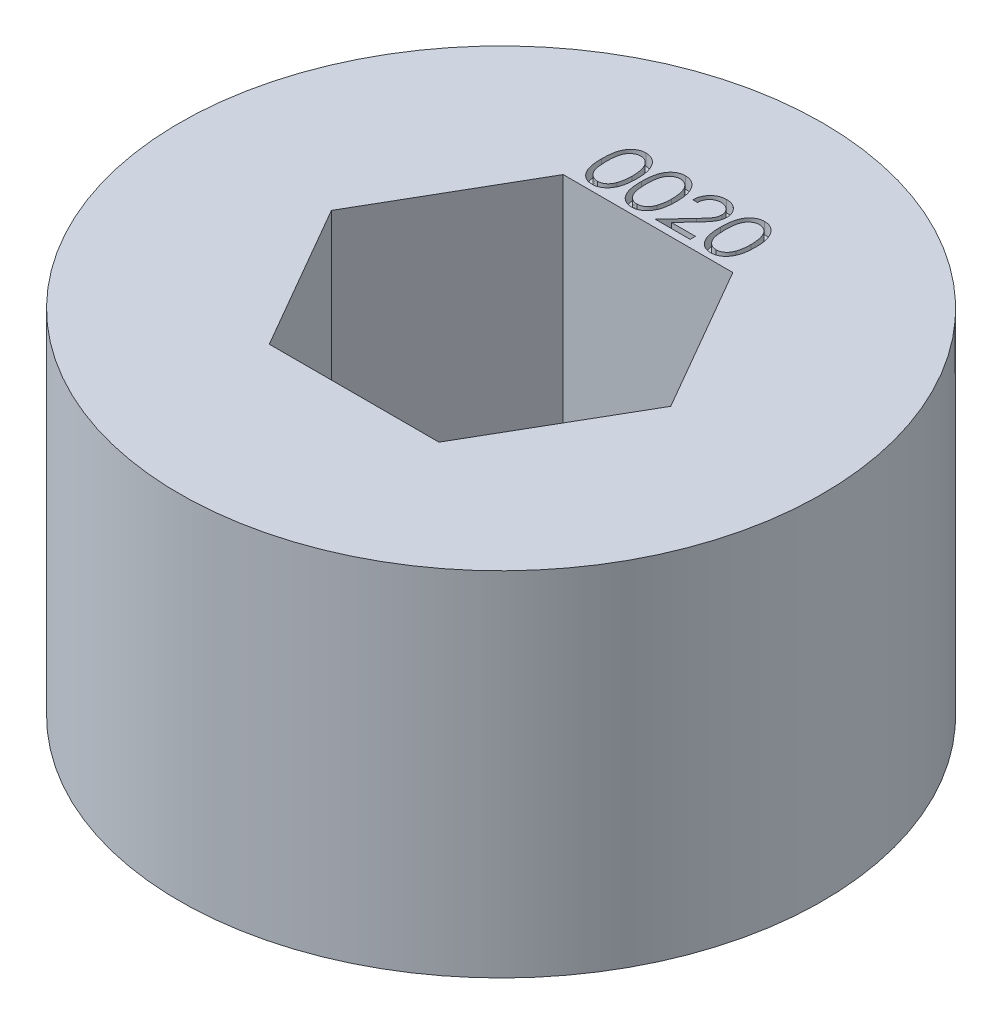
from build123d import *

# Parameters (mm, degrees)
SKETCH1_R           = 11.1125
BOSS_EXTRUDE1_DEPTH = 12.192
CUT_EXTRUDE1_DEPTH  = 0.4


with BuildPart() as part:
    # Sketch1 → Boss-Extrude1 (new body)
    with BuildSketch(Plane(origin=(0, 0, 0), x_dir=(1, 0, 0), z_dir=(0, 1, 0))):
        with Locations(Location((0, 0, 0), (0, 0, 90))):
            Circle(SKETCH1_R)
        Polygon((-2.932939367, 5.08), (-5.865878735, 0), (-2.932939367, -5.08), (2.932939367, -5.08), (5.865878735, 0), (2.932939367, 5.08), align=None, mode=Mode.SUBTRACT)
    extrude(amount=BOSS_EXTRUDE1_DEPTH)

    # Sketch2 → Cut-Extrude1 (cut)
    # profile 1 of 4: a face of its own
    with BuildSketch(Plane(origin=(0, 12.192, 0), x_dir=(1, 0, 0), z_dir=(0, 1, 0))):
        with BuildLine():
            add(Edge.make_bspline(
                [(-2.741641314, 6.22228766), (-2.741474681, 6.250785133), (-2.741150993, 6.306141885), (-2.737550075, 6.386804483), (-2.731568201, 6.46247631), (-2.723370416, 6.533160988), (-2.713394322, 6.598876764), (-2.700076855, 6.659448021), (-2.684931951, 6.715155101), (-2.667379309, 6.766179662), (-2.647573512, 6.813209135), (-2.626016907, 6.857113137), (-2.601853992, 6.897825239), (-2.57646572, 6.935995236), (-2.548824388, 6.970998313), (-2.519716602, 7.003328786), (-2.488006289, 7.032239447), (-2.454771401, 7.058577368), (-2.419711037, 7.0816657), (-2.383824562, 7.102002331), (-2.346864969, 7.119375864), (-2.308731348, 7.133036205), (-2.269766448, 7.144319315), (-2.229834058, 7.152035301), (-2.188868246, 7.15689021), (-2.161217077, 7.157354354), (-2.147193798, 7.157589744)],
                knots=[0, 0, 0, 0, 1.646270934, 3.197905019, 4.663502075, 6.030701355, 7.308322542, 8.50163776, 9.611534131, 10.641858119, 11.616356847, 12.558055219, 13.465016945, 14.349605745, 15.204443733, 16.039544428, 16.859896111, 17.680448484, 18.487036065, 19.28249412, 20.06191084, 20.843045899, 21.620316918, 22.403196591, 23.190181807, 24, 24, 24, 24], degree=3))
            add(Edge.make_bspline(
                [(-2.147193798, 7.157589744), (-2.133053375, 7.157341933), (-2.104932522, 7.156849117), (-2.063357612, 7.152112554), (-2.022743173, 7.144253224), (-1.983262359, 7.133117369), (-1.944590866, 7.119301965), (-1.907031171, 7.101985709), (-1.870349973, 7.081828845), (-1.835130187, 7.058143915), (-1.800985162, 7.031736919), (-1.768753597, 7.001885483), (-1.738432558, 6.968891026), (-1.709641502, 6.933106559), (-1.683197259, 6.893845736), (-1.658013955, 6.851791408), (-1.635472961, 6.806208129), (-1.613763746, 6.757856451), (-1.595025157, 6.705398512), (-1.578125904, 6.649130014), (-1.564471388, 6.588386327), (-1.553097638, 6.523486154), (-1.544286431, 6.454191153), (-1.537869049, 6.380649865), (-1.534479121, 6.302813906), (-1.533840717, 6.249596919), (-1.533513109, 6.22228766)],
                knots=[0, 0, 0, 0, 0.810914788, 1.612654377, 2.396697861, 3.181598691, 3.963628158, 4.749916497, 5.551656086, 6.361998678, 7.18212741, 8.025565596, 8.878627764, 9.750805457, 10.657531673, 11.591944965, 12.560506719, 13.57287815, 14.630710178, 15.753379473, 16.941251878, 18.199788006, 19.531962791, 20.947069417, 22.433333509, 24, 24, 24, 24], degree=3))
            add(Edge.make_bspline(
                [(-1.533513109, 6.22228766), (-1.533844114, 6.195097515), (-1.534489063, 6.142118626), (-1.537831046, 6.06463289), (-1.544414031, 5.991481884), (-1.552648705, 5.922490169), (-1.564053794, 5.857944899), (-1.578077219, 5.797622719), (-1.593647583, 5.741263131), (-1.612867658, 5.689327847), (-1.633904299, 5.641092371), (-1.656792339, 5.59604946), (-1.68131341, 5.553800983), (-1.708028493, 5.514685112), (-1.736503627, 5.478424754), (-1.767348263, 5.445659962), (-1.79969292, 5.41560126), (-1.833938428, 5.388854234), (-1.869707496, 5.365443153), (-1.906262707, 5.344506517), (-1.944252666, 5.327624308), (-1.982816446, 5.313128507), (-2.022505656, 5.302053877), (-2.063270822, 5.294396359), (-2.10490459, 5.28902586), (-2.133048585, 5.288616168), (-2.147193798, 5.288410256)],
                knots=[0, 0, 0, 0, 1.561518951, 3.042555995, 4.452378317, 5.7783523, 7.031515105, 8.214008947, 9.334062868, 10.386615937, 11.391082383, 12.354592575, 13.286541444, 14.194233754, 15.072674879, 15.931287219, 16.775624067, 17.606195743, 18.42308326, 19.229000347, 20.022332153, 20.807536673, 21.593273796, 22.3848459, 23.188221202, 24, 24, 24, 24], degree=3))
            add(Edge.make_bspline(
                [(-2.147193798, 5.288410256), (-2.161216688, 5.288647165), (-2.188867089, 5.289114302), (-2.229838522, 5.293947278), (-2.269606003, 5.301717394), (-2.30836577, 5.312597029), (-2.34631668, 5.325914165), (-2.382941593, 5.343264237), (-2.418647736, 5.363245944), (-2.453339847, 5.386002018), (-2.486366025, 5.412073433), (-2.517912116, 5.440909691), (-2.547185626, 5.473230384), (-2.574431746, 5.508525169), (-2.600326583, 5.546469336), (-2.624146385, 5.58758095), (-2.646178779, 5.631696996), (-2.666317672, 5.679102495), (-2.684173193, 5.730489198), (-2.699945429, 5.786444981), (-2.712398621, 5.847463724), (-2.723057962, 5.913055346), (-2.731655549, 5.983501703), (-2.737525146, 6.058841038), (-2.741152934, 6.139026404), (-2.74147555, 6.19402745), (-2.741641314, 6.22228766)],
                knots=[0, 0, 0, 0, 0.810891512, 1.598919785, 2.382837074, 3.152667961, 3.926044502, 4.706494248, 5.493654104, 6.291793342, 7.103789334, 7.925228297, 8.761435821, 9.622817696, 10.50288917, 11.416980706, 12.369136599, 13.353924996, 14.394355917, 15.514179734, 16.714354668, 17.994756427, 19.357759367, 20.818452758, 22.365282078, 24, 24, 24, 24], degree=3))
        make_face()
        with BuildLine():
            add(Edge.make_bspline(
                [(-2.582077211, 6.223), (-2.582016532, 6.199251661), (-2.581898766, 6.153160798), (-2.578822216, 6.086184422), (-2.574631098, 6.023715495), (-2.569225319, 5.965674698), (-2.561197421, 5.912258492), (-2.552202373, 5.863099493), (-2.541255944, 5.818457856), (-2.528304474, 5.778027248), (-2.513552613, 5.741121522), (-2.497446034, 5.706780104), (-2.480143187, 5.674597321), (-2.460778659, 5.644862248), (-2.439689007, 5.617477916), (-2.417350591, 5.591959637), (-2.392929718, 5.569202771), (-2.359145817, 5.541909529), (-2.314545208, 5.513705809), (-2.258350017, 5.489145995), (-2.200606444, 5.473711707), (-2.161413609, 5.471748919), (-2.14185125, 5.470769231)],
                knots=[0, 0, 0, 0, 1.459021318, 2.831673884, 4.118529203, 5.306027144, 6.411944654, 7.436330062, 8.375795394, 9.233974572, 10.042671642, 10.816086306, 11.563610507, 12.285937304, 12.993564865, 13.685989202, 14.367179055, 15.041617293, 16.353048772, 17.594441528, 18.799311195, 20, 20, 20, 20], degree=3))
            add(Edge.make_bspline(
                [(-2.14185125, 5.470769231), (-2.122162352, 5.471580903), (-2.082825208, 5.473202573), (-2.02535324, 5.488848332), (-1.969559463, 5.512454858), (-1.925834917, 5.54036819), (-1.892569785, 5.566950982), (-1.868735954, 5.589615223), (-1.846860434, 5.614992804), (-1.82611266, 5.642373646), (-1.807083449, 5.672280868), (-1.789779375, 5.704570656), (-1.773989035, 5.739332679), (-1.764992839, 5.763599706), (-1.760393317, 5.776006811)],
                knots=[0, 0, 0, 0, 1.353760809, 2.704726607, 4.075137775, 5.516104923, 6.260822281, 7.007110065, 7.778089737, 8.566572457, 9.372053459, 10.217411131, 11.088608312, 12, 12, 12, 12], degree=3))
            add(Edge.make_bspline(
                [(-1.760393317, 5.776006811), (-1.755033019, 5.791871519), (-1.744149315, 5.824083679), (-1.730122534, 5.874052414), (-1.719075871, 5.926479418), (-1.709137681, 5.981051377), (-1.702354329, 6.038170746), (-1.69689444, 6.097660789), (-1.693678451, 6.159566361), (-1.693279797, 6.201626216), (-1.693077211, 6.223)],
                knots=[0, 0, 0, 0, 0.884706709, 1.796334032, 2.740027952, 3.714592787, 4.726048262, 5.777819803, 6.87074269, 8, 8, 8, 8], degree=3))
            add(Edge.make_bspline(
                [(-1.693077211, 6.223), (-1.693356707, 6.244370327), (-1.693903461, 6.286175255), (-1.695993367, 6.34739849), (-1.701390143, 6.405548113), (-1.707384095, 6.460874633), (-1.716221884, 6.513071787), (-1.72575085, 6.562576542), (-1.738553066, 6.608775598), (-1.752228311, 6.652392266), (-1.767879992, 6.692930998), (-1.785109185, 6.730580802), (-1.803509839, 6.765523442), (-1.823495697, 6.797663048), (-1.844829504, 6.82714358), (-1.868074339, 6.853373954), (-1.89230816, 6.877167134), (-1.926251291, 6.904326119), (-1.97068823, 6.93201806), (-2.025981819, 6.957502266), (-2.083523306, 6.972136879), (-2.122422621, 6.974200216), (-2.14185125, 6.975230769)],
                knots=[0, 0, 0, 0, 1.31362396, 2.569729283, 3.763502607, 4.902122613, 5.988968491, 7.01645872, 7.998833611, 8.933434873, 9.825090667, 10.667526885, 11.477055099, 12.250526234, 12.991942729, 13.710640831, 14.402115721, 15.076753259, 16.378508321, 17.609869233, 18.806226677, 20, 20, 20, 20], degree=3))
            add(Edge.make_bspline(
                [(-2.14185125, 6.975230769), (-2.16151623, 6.974198794), (-2.200882017, 6.972132965), (-2.259021578, 6.957556792), (-2.314751389, 6.932150205), (-2.35907082, 6.9042344), (-2.393037623, 6.877646538), (-2.416955631, 6.854590219), (-2.439381887, 6.829369922), (-2.460041079, 6.801733749), (-2.479390434, 6.772033342), (-2.497160789, 6.74003505), (-2.513171592, 6.705576717), (-2.527946537, 6.668687568), (-2.540937513, 6.628260448), (-2.551653246, 6.583673799), (-2.561552669, 6.534671158), (-2.568560666, 6.480965648), (-2.574790654, 6.422910314), (-2.578794379, 6.360285437), (-2.581909057, 6.293196731), (-2.582020037, 6.246867559), (-2.582077211, 6.223)],
                knots=[0, 0, 0, 0, 1.207732386, 2.417664972, 3.655092373, 4.956220595, 5.625982001, 6.301752483, 6.994047911, 7.697131622, 8.419323945, 9.170223765, 9.943494443, 10.752040957, 11.610060368, 12.549350801, 13.567764191, 14.679664412, 15.874934091, 17.154273443, 18.533957287, 20, 20, 20, 20], degree=3))
        make_face(mode=Mode.SUBTRACT)
    # profile 2 of 4: a face of its own
    with BuildSketch(Plane(origin=(0, 12.192, 0), x_dir=(1, 0, 0), z_dir=(0, 1, 0))):
        with BuildLine():
            add(Edge.make_bspline(
                [(-1.373949006, 6.22228766), (-1.373782373, 6.250785133), (-1.373458685, 6.306141885), (-1.369857768, 6.386804483), (-1.363875894, 6.46247631), (-1.355678108, 6.533160988), (-1.345702014, 6.598876764), (-1.332384547, 6.659448021), (-1.317239643, 6.715155101), (-1.299687001, 6.766179662), (-1.279881204, 6.813209135), (-1.2583246, 6.857113137), (-1.234161684, 6.897825239), (-1.208773412, 6.935995236), (-1.18113208, 6.970998313), (-1.152024294, 7.003328786), (-1.120313981, 7.032239447), (-1.087079093, 7.058577368), (-1.052018729, 7.0816657), (-1.016132255, 7.102002331), (-0.979172661, 7.119375864), (-0.94103904, 7.133036205), (-0.902074141, 7.144319315), (-0.862141751, 7.152035301), (-0.821175938, 7.15689021), (-0.793524769, 7.157354354), (-0.77950149, 7.157589744)],
                knots=[0, 0, 0, 0, 1.646270934, 3.197905019, 4.663502075, 6.030701355, 7.308322542, 8.50163776, 9.611534131, 10.641858119, 11.616356847, 12.558055219, 13.465016945, 14.349605745, 15.204443733, 16.039544428, 16.859896111, 17.680448484, 18.487036065, 19.28249412, 20.06191084, 20.843045899, 21.620316918, 22.403196591, 23.190181807, 24, 24, 24, 24], degree=3))
            add(Edge.make_bspline(
                [(-0.77950149, 7.157589744), (-0.765361067, 7.157341933), (-0.737240214, 7.156849117), (-0.695665304, 7.152112554), (-0.655050865, 7.144253224), (-0.615570051, 7.133117369), (-0.576898558, 7.119301965), (-0.539338863, 7.101985709), (-0.502657665, 7.081828845), (-0.467437879, 7.058143915), (-0.433292855, 7.031736919), (-0.40106129, 7.001885483), (-0.37074025, 6.968891026), (-0.341949195, 6.933106559), (-0.315504951, 6.893845736), (-0.290321648, 6.851791408), (-0.267780654, 6.806208129), (-0.246071439, 6.757856451), (-0.227332849, 6.705398512), (-0.210433597, 6.649130014), (-0.196779081, 6.588386327), (-0.18540533, 6.523486154), (-0.176594123, 6.454191153), (-0.170176741, 6.380649865), (-0.166786814, 6.302813906), (-0.16614841, 6.249596919), (-0.165820801, 6.22228766)],
                knots=[0, 0, 0, 0, 0.810914788, 1.612654377, 2.396697861, 3.181598691, 3.963628158, 4.749916497, 5.551656086, 6.361998678, 7.18212741, 8.025565596, 8.878627764, 9.750805457, 10.657531673, 11.591944965, 12.560506719, 13.57287815, 14.630710178, 15.753379473, 16.941251878, 18.199788006, 19.531962791, 20.947069417, 22.433333509, 24, 24, 24, 24], degree=3))
            add(Edge.make_bspline(
                [(-0.165820801, 6.22228766), (-0.166151806, 6.195097515), (-0.166796756, 6.142118626), (-0.170138739, 6.06463289), (-0.176721723, 5.991481884), (-0.184956397, 5.922490169), (-0.196361486, 5.857944899), (-0.210384911, 5.797622719), (-0.225955275, 5.741263131), (-0.24517535, 5.689327847), (-0.266211991, 5.641092371), (-0.289100031, 5.59604946), (-0.313621102, 5.553800983), (-0.340336185, 5.514685112), (-0.368811319, 5.478424754), (-0.399655956, 5.445659962), (-0.432000613, 5.41560126), (-0.46624612, 5.388854234), (-0.502015188, 5.365443153), (-0.538570399, 5.344506517), (-0.576560358, 5.327624308), (-0.615124138, 5.313128507), (-0.654813348, 5.302053877), (-0.695578514, 5.294396359), (-0.737212282, 5.28902586), (-0.765356277, 5.288616168), (-0.77950149, 5.288410256)],
                knots=[0, 0, 0, 0, 1.561518951, 3.042555995, 4.452378317, 5.7783523, 7.031515105, 8.214008947, 9.334062868, 10.386615937, 11.391082383, 12.354592575, 13.286541444, 14.194233754, 15.072674879, 15.931287219, 16.775624067, 17.606195743, 18.42308326, 19.229000347, 20.022332153, 20.807536673, 21.593273796, 22.3848459, 23.188221202, 24, 24, 24, 24], degree=3))
            add(Edge.make_bspline(
                [(-0.77950149, 5.288410256), (-0.79352438, 5.288647165), (-0.821174782, 5.289114302), (-0.862146214, 5.293947278), (-0.901913695, 5.301717394), (-0.940673462, 5.312597029), (-0.978624372, 5.325914165), (-1.015249285, 5.343264237), (-1.050955429, 5.363245944), (-1.085647539, 5.386002018), (-1.118673717, 5.412073433), (-1.150219809, 5.440909691), (-1.179493318, 5.473230384), (-1.206739439, 5.508525169), (-1.232634276, 5.546469336), (-1.256454077, 5.58758095), (-1.278486471, 5.631696996), (-1.298625364, 5.679102495), (-1.316480885, 5.730489198), (-1.332253121, 5.786444981), (-1.344706313, 5.847463724), (-1.355365654, 5.913055346), (-1.363963241, 5.983501703), (-1.369832838, 6.058841038), (-1.373460626, 6.139026404), (-1.373783242, 6.19402745), (-1.373949006, 6.22228766)],
                knots=[0, 0, 0, 0, 0.810891512, 1.598919785, 2.382837074, 3.152667961, 3.926044502, 4.706494248, 5.493654104, 6.291793342, 7.103789334, 7.925228297, 8.761435821, 9.622817696, 10.50288917, 11.416980706, 12.369136599, 13.353924996, 14.394355917, 15.514179734, 16.714354668, 17.994756427, 19.357759367, 20.818452758, 22.365282078, 24, 24, 24, 24], degree=3))
        make_face()
        with BuildLine():
            add(Edge.make_bspline(
                [(-1.214384903, 6.223), (-1.214324224, 6.199251661), (-1.214206458, 6.153160798), (-1.211129908, 6.086184422), (-1.20693879, 6.023715495), (-1.201533011, 5.965674698), (-1.193505114, 5.912258492), (-1.184510065, 5.863099493), (-1.173563636, 5.818457856), (-1.160612167, 5.778027248), (-1.145860306, 5.741121522), (-1.129753727, 5.706780104), (-1.11245088, 5.674597321), (-1.093086351, 5.644862248), (-1.071996699, 5.617477916), (-1.049658283, 5.591959637), (-1.025237411, 5.569202771), (-0.991453509, 5.541909529), (-0.9468529, 5.513705809), (-0.890657709, 5.489145995), (-0.832914136, 5.473711707), (-0.793721301, 5.471748919), (-0.774158942, 5.470769231)],
                knots=[0, 0, 0, 0, 1.459021318, 2.831673884, 4.118529203, 5.306027144, 6.411944654, 7.436330062, 8.375795394, 9.233974572, 10.042671642, 10.816086306, 11.563610507, 12.285937304, 12.993564865, 13.685989202, 14.367179055, 15.041617293, 16.353048772, 17.594441528, 18.799311195, 20, 20, 20, 20], degree=3))
            add(Edge.make_bspline(
                [(-0.774158942, 5.470769231), (-0.754470045, 5.471580903), (-0.715132901, 5.473202573), (-0.657660933, 5.488848332), (-0.601867155, 5.512454858), (-0.55814261, 5.54036819), (-0.524877478, 5.566950982), (-0.501043647, 5.589615223), (-0.479168126, 5.614992804), (-0.458420352, 5.642373646), (-0.439391142, 5.672280868), (-0.422087068, 5.704570656), (-0.406296727, 5.739332679), (-0.397300532, 5.763599706), (-0.392701009, 5.776006811)],
                knots=[0, 0, 0, 0, 1.353760809, 2.704726607, 4.075137775, 5.516104923, 6.260822281, 7.007110065, 7.778089737, 8.566572457, 9.372053459, 10.217411131, 11.088608312, 12, 12, 12, 12], degree=3))
            add(Edge.make_bspline(
                [(-0.392701009, 5.776006811), (-0.387340711, 5.791871519), (-0.376457007, 5.824083679), (-0.362430226, 5.874052414), (-0.351383563, 5.926479418), (-0.341445373, 5.981051377), (-0.334662021, 6.038170746), (-0.329202132, 6.097660789), (-0.325986143, 6.159566361), (-0.325587489, 6.201626216), (-0.325384903, 6.223)],
                knots=[0, 0, 0, 0, 0.884706709, 1.796334032, 2.740027952, 3.714592787, 4.726048262, 5.777819803, 6.87074269, 8, 8, 8, 8], degree=3))
            add(Edge.make_bspline(
                [(-0.325384903, 6.223), (-0.3256644, 6.244370327), (-0.326211154, 6.286175255), (-0.32830106, 6.34739849), (-0.333697835, 6.405548113), (-0.339691788, 6.460874633), (-0.348529576, 6.513071787), (-0.358058542, 6.562576542), (-0.370860758, 6.608775598), (-0.384536004, 6.652392266), (-0.400187684, 6.692930998), (-0.417416877, 6.730580802), (-0.435817531, 6.765523442), (-0.455803389, 6.797663048), (-0.477137196, 6.82714358), (-0.500382031, 6.853373954), (-0.524615852, 6.877167134), (-0.558558983, 6.904326119), (-0.602995922, 6.93201806), (-0.658289511, 6.957502266), (-0.715830998, 6.972136879), (-0.754730313, 6.974200216), (-0.774158942, 6.975230769)],
                knots=[0, 0, 0, 0, 1.31362396, 2.569729283, 3.763502607, 4.902122613, 5.988968491, 7.01645872, 7.998833611, 8.933434873, 9.825090667, 10.667526885, 11.477055099, 12.250526234, 12.991942729, 13.710640831, 14.402115721, 15.076753259, 16.378508321, 17.609869233, 18.806226677, 20, 20, 20, 20], degree=3))
            add(Edge.make_bspline(
                [(-0.774158942, 6.975230769), (-0.793823923, 6.974198794), (-0.833189709, 6.972132965), (-0.89132927, 6.957556792), (-0.947059081, 6.932150205), (-0.991378512, 6.9042344), (-1.025345315, 6.877646538), (-1.049263324, 6.854590219), (-1.071689579, 6.829369922), (-1.092348771, 6.801733749), (-1.111698127, 6.772033342), (-1.129468481, 6.74003505), (-1.145479285, 6.705576717), (-1.160254229, 6.668687568), (-1.173245205, 6.628260448), (-1.183960939, 6.583673799), (-1.193860362, 6.534671158), (-1.200868358, 6.480965648), (-1.207098346, 6.422910314), (-1.211102071, 6.360285437), (-1.21421675, 6.293196731), (-1.21432773, 6.246867559), (-1.214384903, 6.223)],
                knots=[0, 0, 0, 0, 1.207732386, 2.417664972, 3.655092373, 4.956220595, 5.625982001, 6.301752483, 6.994047911, 7.697131622, 8.419323945, 9.170223765, 9.943494443, 10.752040957, 11.610060368, 12.549350801, 13.567764191, 14.679664412, 15.874934091, 17.154273443, 18.533957287, 20, 20, 20, 20], degree=3))
        make_face(mode=Mode.SUBTRACT)
    # profile 3 of 4: a face of its own
    with BuildSketch(Plane(origin=(0, 12.192, 0), x_dir=(1, 0, 0), z_dir=(0, 1, 0))):
        with BuildLine():
            Line((0.22169202, 6.564923077), (0.062127917, 6.564923077))
            add(Edge.make_bspline(
                [(0.062127917, 6.564923077), (0.063167871, 6.586091888), (0.065210312, 6.627666869), (0.074775083, 6.688283414), (0.088461049, 6.746223252), (0.107811507, 6.801021168), (0.131843097, 6.853161682), (0.16066195, 6.90243769), (0.194796426, 6.948661214), (0.233509447, 6.991403746), (0.275555916, 7.030615032), (0.320923333, 7.064475895), (0.368596607, 7.093085272), (0.418431102, 7.117002543), (0.470989068, 7.134955185), (0.52579356, 7.148275778), (0.583085361, 7.156290162), (0.622120092, 7.157151621), (0.641972468, 7.157589744)],
                knots=[0, 0, 0, 0, 1.10065271, 2.161652631, 3.183658789, 4.190468796, 5.17591951, 6.163126047, 7.15150782, 8.156236427, 9.156009102, 10.134482811, 11.092018607, 12.041330605, 13.001268258, 13.972401359, 14.968799086, 16, 16, 16, 16], degree=3))
            add(Edge.make_bspline(
                [(0.641972468, 7.157589744), (0.66146853, 7.157133328), (0.699777595, 7.156236487), (0.755689098, 7.148534684), (0.808915964, 7.136471923), (0.859354149, 7.119547692), (0.90660123, 7.096797203), (0.951012136, 7.069468053), (0.993115588, 7.037860379), (1.031015834, 7.000647442), (1.065817939, 6.96092063), (1.095841884, 6.918508775), (1.121553371, 6.874704298), (1.142984713, 6.829173172), (1.158761231, 6.781486689), (1.170738961, 6.73233911), (1.177509287, 6.681221706), (1.178548362, 6.646623576), (1.179076635, 6.629033654)],
                knots=[0, 0, 0, 0, 1.111607364, 2.184268762, 3.212621178, 4.221274766, 5.211760367, 6.196651075, 7.1921475, 8.207485113, 9.220403448, 10.201281604, 11.166441695, 12.114753415, 13.065576456, 14.026450734, 14.996634279, 16, 16, 16, 16], degree=3))
            add(Edge.make_bspline(
                [(1.179076635, 6.629033654), (1.178216457, 6.604269754), (1.176511197, 6.555176525), (1.161924294, 6.483032975), (1.139142266, 6.413135518), (1.111711609, 6.356880969), (1.084039607, 6.311550354), (1.059103154, 6.274228252), (1.02991103, 6.234042674), (0.996038353, 6.191128186), (0.958185814, 6.145148647), (0.916010555, 6.096131831), (0.869211826, 6.044584172), (0.836365307, 6.009376926), (0.819345064, 5.991133413)],
                knots=[0, 0, 0, 0, 1.184426356, 2.348067706, 3.509069118, 4.696110526, 5.333549288, 6.050745305, 6.844228056, 7.710549037, 8.667450064, 9.695053472, 10.805634456, 12, 12, 12, 12], degree=3))
            Line((0.819345064, 5.991133413), (0.374488895, 5.516358974))
            Line((0.374488895, 5.516358974), (1.201871507, 5.516358974))
            Line((1.201871507, 5.516358974), (1.201871507, 5.334))
            Line((1.201871507, 5.334), (-0.006256698, 5.334))
            Line((-0.006256698, 5.334), (0.683288173, 6.069846955))
            add(Edge.make_bspline(
                [(0.683288173, 6.069846955), (0.7000765, 6.087372095), (0.732323439, 6.121034302), (0.777932988, 6.170179725), (0.818897594, 6.215772492), (0.85548243, 6.257726459), (0.886893851, 6.296655295), (0.914768944, 6.331298205), (0.937103465, 6.363177465), (0.961342886, 6.400129697), (0.984819588, 6.445246354), (1.004993465, 6.500381468), (1.017294608, 6.557138913), (1.018770265, 6.595493948), (1.019512532, 6.614786859)],
                knots=[0, 0, 0, 0, 1.329631726, 2.553950428, 3.673215718, 4.687767853, 5.603093632, 6.413772471, 7.123043292, 7.734684054, 8.834405432, 9.900288307, 10.943827018, 12, 12, 12, 12], degree=3))
            add(Edge.make_bspline(
                [(1.019512532, 6.614786859), (1.019189575, 6.626918609), (1.018553089, 6.65082796), (1.012935779, 6.685882885), (1.004446841, 6.719697811), (0.99228265, 6.752376749), (0.976226426, 6.783591141), (0.956681949, 6.81337898), (0.934131797, 6.842176975), (0.908045352, 6.86917885), (0.8793883, 6.893908903), (0.849114422, 6.915815938), (0.817084969, 6.934123806), (0.783434987, 6.949131903), (0.748258288, 6.960904996), (0.711486838, 6.969062755), (0.673222237, 6.974184657), (0.647094021, 6.974877656), (0.633780561, 6.975230769)],
                knots=[0, 0, 0, 0, 0.991446411, 1.95395049, 2.89581595, 3.838931463, 4.798493298, 5.75982156, 6.748411868, 7.785213223, 8.824556874, 9.840280684, 10.836137867, 11.835679398, 12.848801643, 13.863922112, 14.911575587, 16, 16, 16, 16], degree=3))
            add(Edge.make_bspline(
                [(0.633780561, 6.975230769), (0.619876178, 6.974867533), (0.592570266, 6.974154197), (0.552479397, 6.969164283), (0.514234222, 6.960555796), (0.477738535, 6.948782046), (0.442930586, 6.933817103), (0.409979651, 6.915177697), (0.378959704, 6.892935682), (0.34981243, 6.867718279), (0.322957528, 6.839642338), (0.299362515, 6.808344477), (0.278745836, 6.77439615), (0.260757946, 6.737888958), (0.246150055, 6.698491638), (0.234987695, 6.656344044), (0.226155177, 6.611629182), (0.223204448, 6.580750359), (0.22169202, 6.564923077)],
                knots=[0, 0, 0, 0, 1.031018746, 2.02475058, 2.990194455, 3.934040569, 4.864654155, 5.795059489, 6.735614925, 7.690564532, 8.649604399, 9.611025574, 10.590972636, 11.591080095, 12.624614302, 13.701020113, 14.821632451, 16, 16, 16, 16], degree=3))
        make_face()
    # profile 4 of 4: a face of its own
    with BuildSketch(Plane(origin=(0, 12.192, 0), x_dir=(1, 0, 0), z_dir=(0, 1, 0))):
        with BuildLine():
            add(Edge.make_bspline(
                [(1.361435609, 6.22228766), (1.361602243, 6.250785133), (1.36192593, 6.306141885), (1.365526848, 6.386804483), (1.371508722, 6.46247631), (1.379706507, 6.533160988), (1.389682601, 6.598876764), (1.403000068, 6.659448021), (1.418144972, 6.715155101), (1.435697614, 6.766179662), (1.455503411, 6.813209135), (1.477060016, 6.857113137), (1.501222931, 6.897825239), (1.526611203, 6.935995236), (1.554252535, 6.970998313), (1.583360321, 7.003328786), (1.615070634, 7.032239447), (1.648305522, 7.058577368), (1.683365886, 7.0816657), (1.719252361, 7.102002331), (1.756211954, 7.119375864), (1.794345575, 7.133036205), (1.833310475, 7.144319315), (1.873242865, 7.152035301), (1.914208678, 7.15689021), (1.941859846, 7.157354354), (1.955883125, 7.157589744)],
                knots=[0, 0, 0, 0, 1.646270934, 3.197905019, 4.663502075, 6.030701355, 7.308322542, 8.50163776, 9.611534131, 10.641858119, 11.616356847, 12.558055219, 13.465016945, 14.349605745, 15.204443733, 16.039544428, 16.859896111, 17.680448484, 18.487036065, 19.28249412, 20.06191084, 20.843045899, 21.620316918, 22.403196591, 23.190181807, 24, 24, 24, 24], degree=3))
            add(Edge.make_bspline(
                [(1.955883125, 7.157589744), (1.970023548, 7.157341933), (1.998144401, 7.156849117), (2.039719312, 7.152112554), (2.08033375, 7.144253224), (2.119814564, 7.133117369), (2.158486057, 7.119301965), (2.196045753, 7.101985709), (2.23272695, 7.081828845), (2.267946736, 7.058143915), (2.302091761, 7.031736919), (2.334323326, 7.001885483), (2.364644366, 6.968891026), (2.393435421, 6.933106559), (2.419879664, 6.893845736), (2.445062968, 6.851791408), (2.467603962, 6.806208129), (2.489313177, 6.757856451), (2.508051766, 6.705398512), (2.524951019, 6.649130014), (2.538605535, 6.588386327), (2.549979285, 6.523486154), (2.558790492, 6.454191153), (2.565207874, 6.380649865), (2.568597802, 6.302813906), (2.569236206, 6.249596919), (2.569563814, 6.22228766)],
                knots=[0, 0, 0, 0, 0.810914788, 1.612654377, 2.396697861, 3.181598691, 3.963628158, 4.749916497, 5.551656086, 6.361998678, 7.18212741, 8.025565596, 8.878627764, 9.750805457, 10.657531673, 11.591944965, 12.560506719, 13.57287815, 14.630710178, 15.753379473, 16.941251878, 18.199788006, 19.531962791, 20.947069417, 22.433333509, 24, 24, 24, 24], degree=3))
            add(Edge.make_bspline(
                [(2.569563814, 6.22228766), (2.56923281, 6.195097515), (2.56858786, 6.142118626), (2.565245877, 6.06463289), (2.558662892, 5.991481884), (2.550428218, 5.922490169), (2.539023129, 5.857944899), (2.524999704, 5.797622719), (2.50942934, 5.741263131), (2.490209265, 5.689327847), (2.469172624, 5.641092371), (2.446284585, 5.59604946), (2.421763513, 5.553800983), (2.39504843, 5.514685112), (2.366573297, 5.478424754), (2.33572866, 5.445659962), (2.303384003, 5.41560126), (2.269138495, 5.388854234), (2.233369427, 5.365443153), (2.196814216, 5.344506517), (2.158824258, 5.327624308), (2.120260478, 5.313128507), (2.080571268, 5.302053877), (2.039806101, 5.294396359), (1.998172333, 5.28902586), (1.970028338, 5.288616168), (1.955883125, 5.288410256)],
                knots=[0, 0, 0, 0, 1.561518951, 3.042555995, 4.452378317, 5.7783523, 7.031515105, 8.214008947, 9.334062868, 10.386615937, 11.391082383, 12.354592575, 13.286541444, 14.194233754, 15.072674879, 15.931287219, 16.775624067, 17.606195743, 18.42308326, 19.229000347, 20.022332153, 20.807536673, 21.593273796, 22.3848459, 23.188221202, 24, 24, 24, 24], degree=3))
            add(Edge.make_bspline(
                [(1.955883125, 5.288410256), (1.941860235, 5.288647165), (1.914209834, 5.289114302), (1.873238402, 5.293947278), (1.83347092, 5.301717394), (1.794711153, 5.312597029), (1.756760244, 5.325914165), (1.72013533, 5.343264237), (1.684429187, 5.363245944), (1.649737076, 5.386002018), (1.616710898, 5.412073433), (1.585164807, 5.440909691), (1.555891297, 5.473230384), (1.528645177, 5.508525169), (1.50275034, 5.546469336), (1.478930538, 5.58758095), (1.456898144, 5.631696996), (1.436759251, 5.679102495), (1.41890373, 5.730489198), (1.403131494, 5.786444981), (1.390678302, 5.847463724), (1.380018961, 5.913055346), (1.371421374, 5.983501703), (1.365551777, 6.058841038), (1.361923989, 6.139026404), (1.361601373, 6.19402745), (1.361435609, 6.22228766)],
                knots=[0, 0, 0, 0, 0.810891512, 1.598919785, 2.382837074, 3.152667961, 3.926044502, 4.706494248, 5.493654104, 6.291793342, 7.103789334, 7.925228297, 8.761435821, 9.622817696, 10.50288917, 11.416980706, 12.369136599, 13.353924996, 14.394355917, 15.514179734, 16.714354668, 17.994756427, 19.357759367, 20.818452758, 22.365282078, 24, 24, 24, 24], degree=3))
        make_face()
        with BuildLine():
            add(Edge.make_bspline(
                [(1.520999712, 6.223), (1.521060391, 6.199251661), (1.521178157, 6.153160798), (1.524254707, 6.086184422), (1.528445825, 6.023715495), (1.533851604, 5.965674698), (1.541879502, 5.912258492), (1.55087455, 5.863099493), (1.56182098, 5.818457856), (1.574772449, 5.778027248), (1.58952431, 5.741121522), (1.605630889, 5.706780104), (1.622933736, 5.674597321), (1.642298264, 5.644862248), (1.663387916, 5.617477916), (1.685726332, 5.591959637), (1.710147205, 5.569202771), (1.743931106, 5.541909529), (1.788531715, 5.513705809), (1.844726906, 5.489145995), (1.902470479, 5.473711707), (1.941663314, 5.471748919), (1.961225673, 5.470769231)],
                knots=[0, 0, 0, 0, 1.459021318, 2.831673884, 4.118529203, 5.306027144, 6.411944654, 7.436330062, 8.375795394, 9.233974572, 10.042671642, 10.816086306, 11.563610507, 12.285937304, 12.993564865, 13.685989202, 14.367179055, 15.041617293, 16.353048772, 17.594441528, 18.799311195, 20, 20, 20, 20], degree=3))
            add(Edge.make_bspline(
                [(1.961225673, 5.470769231), (1.980914571, 5.471580903), (2.020251715, 5.473202573), (2.077723683, 5.488848332), (2.13351746, 5.512454858), (2.177242006, 5.54036819), (2.210507138, 5.566950982), (2.234340969, 5.589615223), (2.256216489, 5.614992804), (2.276964263, 5.642373646), (2.295993474, 5.672280868), (2.313297548, 5.704570656), (2.329087888, 5.739332679), (2.338084084, 5.763599706), (2.342683606, 5.776006811)],
                knots=[0, 0, 0, 0, 1.353760809, 2.704726607, 4.075137775, 5.516104923, 6.260822281, 7.007110065, 7.778089737, 8.566572457, 9.372053459, 10.217411131, 11.088608312, 12, 12, 12, 12], degree=3))
            add(Edge.make_bspline(
                [(2.342683606, 5.776006811), (2.348043904, 5.791871519), (2.358927608, 5.824083679), (2.372954389, 5.874052414), (2.384001052, 5.926479418), (2.393939242, 5.981051377), (2.400722594, 6.038170746), (2.406182483, 6.097660789), (2.409398472, 6.159566361), (2.409797126, 6.201626216), (2.409999712, 6.223)],
                knots=[0, 0, 0, 0, 0.884706709, 1.796334032, 2.740027952, 3.714592787, 4.726048262, 5.777819803, 6.87074269, 8, 8, 8, 8], degree=3))
            add(Edge.make_bspline(
                [(2.409999712, 6.223), (2.409720216, 6.244370327), (2.409173462, 6.286175255), (2.407083556, 6.34739849), (2.40168678, 6.405548113), (2.395692828, 6.460874633), (2.386855039, 6.513071787), (2.377326073, 6.562576542), (2.364523858, 6.608775598), (2.350848612, 6.652392266), (2.335196931, 6.692930998), (2.317967738, 6.730580802), (2.299567084, 6.765523442), (2.279581226, 6.797663048), (2.258247419, 6.82714358), (2.235002584, 6.853373954), (2.210768763, 6.877167134), (2.176825633, 6.904326119), (2.132388693, 6.93201806), (2.077095104, 6.957502266), (2.019553617, 6.972136879), (1.980654303, 6.974200216), (1.961225673, 6.975230769)],
                knots=[0, 0, 0, 0, 1.31362396, 2.569729283, 3.763502607, 4.902122613, 5.988968491, 7.01645872, 7.998833611, 8.933434873, 9.825090667, 10.667526885, 11.477055099, 12.250526234, 12.991942729, 13.710640831, 14.402115721, 15.076753259, 16.378508321, 17.609869233, 18.806226677, 20, 20, 20, 20], degree=3))
            add(Edge.make_bspline(
                [(1.961225673, 6.975230769), (1.941560693, 6.974198794), (1.902194906, 6.972132965), (1.844055345, 6.957556792), (1.788325535, 6.932150205), (1.744006103, 6.9042344), (1.7100393, 6.877646538), (1.686121292, 6.854590219), (1.663695036, 6.829369922), (1.643035844, 6.801733749), (1.623686489, 6.772033342), (1.605916134, 6.74003505), (1.589905331, 6.705576717), (1.575130386, 6.668687568), (1.56213941, 6.628260448), (1.551423677, 6.583673799), (1.541524254, 6.534671158), (1.534516257, 6.480965648), (1.528286269, 6.422910314), (1.524282544, 6.360285437), (1.521167866, 6.293196731), (1.521056886, 6.246867559), (1.520999712, 6.223)],
                knots=[0, 0, 0, 0, 1.207732386, 2.417664972, 3.655092373, 4.956220595, 5.625982001, 6.301752483, 6.994047911, 7.697131622, 8.419323945, 9.170223765, 9.943494443, 10.752040957, 11.610060368, 12.549350801, 13.567764191, 14.679664412, 15.874934091, 17.154273443, 18.533957287, 20, 20, 20, 20], degree=3))
        make_face(mode=Mode.SUBTRACT)
    extrude(amount=-CUT_EXTRUDE1_DEPTH, mode=Mode.SUBTRACT)


solid = part.part
